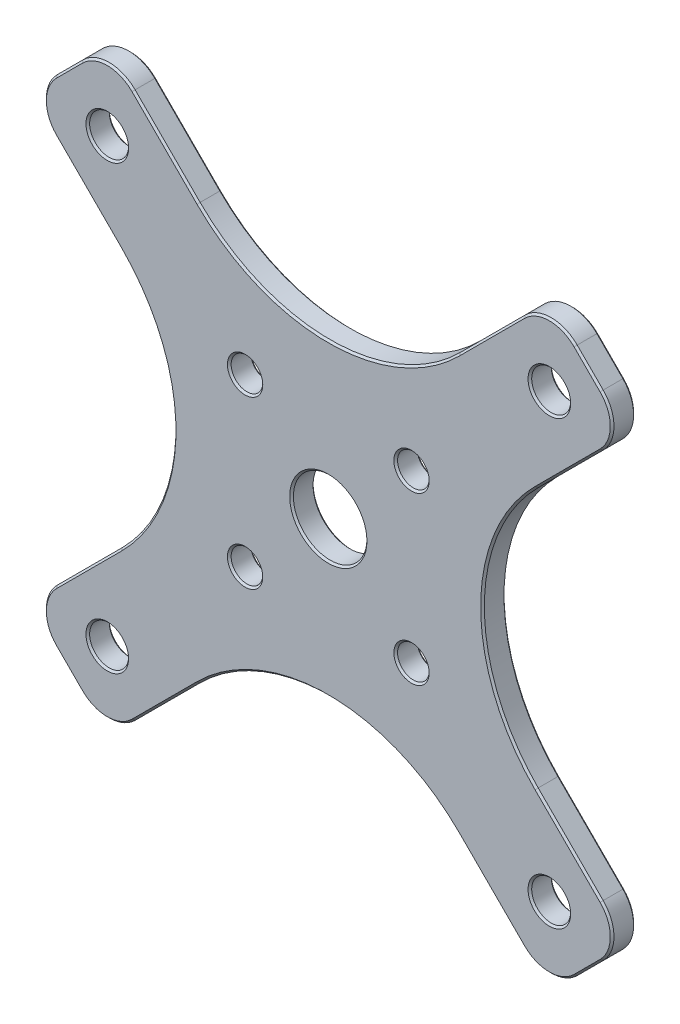
from build123d import *

# Parameters (mm, degrees)
SKETCH1_R            = 5
BOSS_EXTRUDE1_DEPTH  = 1.5875
M4_CLEARANCE_HOLE1_D = 4.3
M5_CLEARANCE_HOLE1_D = 5.3
FILLET1_R            = 25
FILLET2_R            = 5
CHAMFER1_SIZE        = 0.25


with BuildPart() as part:
    # Sketch1 → Boss-Extrude1 (new, symmetric)
    with BuildSketch(Plane.XY):
        Polygon((0, 10.606601718), (30.0520382, 40.658639918), (40.658639918, 30.0520382), (10.606601718, 0), (40.658639918, -30.0520382), (30.0520382, -40.658639918), (0, -10.606601718), (-30.0520382, -40.658639918), (-40.658639918, -30.0520382), (-10.606601718, 0), (-40.658639918, 30.0520382), (-30.0520382, 40.658639918), align=None)
        Circle(SKETCH1_R, mode=Mode.SUBTRACT)
    extrude(amount=BOSS_EXTRUDE1_DEPTH, both=True)

    # M4 Clearance Hole1 (through all)
    with Locations(Plane.XY.offset(1.5875)):
        with Locations((-11.313708499, 11.313708499), (11.313708499, 11.313708499), (11.313708499, -11.313708499), (-11.313708499, -11.313708499)):
            Hole(M4_CLEARANCE_HOLE1_D / 2)

    # M5 Clearance Hole1 (through all)
    with Locations(Plane(origin=(0, 0, -1.5875), x_dir=(-1, 0, 0), z_dir=(0, 0, -1))):
        with Locations((-30.0520382, 30.0520382), (30.0520382, 30.0520382), (30.0520382, -30.0520382), (-30.0520382, -30.0520382)):
            Hole(M5_CLEARANCE_HOLE1_D / 2)

    # Fillet1
    fillet1_edges = [part.edges().sort_by_distance(p)[0] for p in [
        (0, 10.606601718, 0),
        (10.606601718, 0, 0),
        (0, -10.606601718, 0),
        (-10.606601718, 0, 0),
    ]]
    fillet(fillet1_edges, radius=FILLET1_R)

    # Fillet2
    fillet2_edges = [part.edges().sort_by_distance(p)[0] for p in [
        (30.0520382, 40.658639918, 0),
        (40.658639918, 30.0520382, 0),
        (40.658639918, -30.0520382, 0),
        (30.0520382, -40.658639918, 0),
        (-30.0520382, -40.658639918, 0),
        (-40.658639918, -30.0520382, 0),
        (-40.658639918, 30.0520382, 0),
        (-30.0520382, 40.658639918, 0),
    ]]
    fillet(fillet2_edges, radius=FILLET2_R)

    # Chamfer1
    chamfer1_edges = [part.edges().sort_by_distance(p)[0] for p in [
        (-22.097086912, 32.70368863, -1.5875),
        (-22.097086912, 32.70368863, 1.5875),
        (-20.961940777, 0, -1.5875),
        (-20.961940777, 0, 1.5875),
        (0, -20.961940777, -1.5875),
        (0, -20.961940777, 1.5875),
        (20.961940777, 0, -1.5875),
        (20.961940777, 0, 1.5875),
        (0, 20.961940777, -1.5875),
        (0, 20.961940777, 1.5875),
        (32.70368863, -22.097086912, -1.5875),
        (32.70368863, -22.097086912, 1.5875),
        (22.097086912, 32.70368863, -1.5875),
        (35.355339059, 35.355339059, -1.5875),
        (35.355339059, -35.355339059, -1.5875),
        (-22.097086912, -32.70368863, -1.5875),
        (-35.355339059, -35.355339059, -1.5875),
        (-32.70368863, 22.097086912, -1.5875),
        (-35.355339059, 35.355339059, -1.5875),
        (38.587572106, 30.0520382, -1.5875),
        (30.0520382, 38.587572106, -1.5875),
        (-30.0520382, 38.587572106, -1.5875),
        (-38.587572106, 30.0520382, -1.5875),
        (-38.587572106, -30.0520382, -1.5875),
        (-30.0520382, -38.587572106, -1.5875),
        (30.0520382, -38.587572106, -1.5875),
        (38.587572106, -30.0520382, -1.5875),
        (35.355339059, -35.355339059, 1.5875),
        (22.097086912, 32.70368863, 1.5875),
        (-35.355339059, 35.355339059, 1.5875),
        (-32.70368863, 22.097086912, 1.5875),
        (-35.355339059, -35.355339059, 1.5875),
        (-22.097086912, -32.70368863, 1.5875),
        (35.355339059, 35.355339059, 1.5875),
        (38.587572106, 30.0520382, 1.5875),
        (30.0520382, 38.587572106, 1.5875),
        (-30.0520382, 38.587572106, 1.5875),
        (-38.587572106, 30.0520382, 1.5875),
        (-38.587572106, -30.0520382, 1.5875),
        (-30.0520382, -38.587572106, 1.5875),
        (30.0520382, -38.587572106, 1.5875),
        (38.587572106, -30.0520382, 1.5875),
        (-5, 0, -1.5875),
        (-5, 0, 1.5875),
        (-9.163708499, 11.313708499, 1.5875),
        (-9.163708499, 11.313708499, -1.5875),
        (-9.163708499, -11.313708499, 1.5875),
        (-9.163708499, -11.313708499, -1.5875),
        (13.463708499, -11.313708499, 1.5875),
        (13.463708499, -11.313708499, -1.5875),
        (13.463708499, 11.313708499, 1.5875),
        (13.463708499, 11.313708499, -1.5875),
        (27.4020382, -30.0520382, -1.5875),
        (27.4020382, -30.0520382, 1.5875),
        (-32.7020382, -30.0520382, -1.5875),
        (-32.7020382, -30.0520382, 1.5875),
        (-32.7020382, 30.0520382, -1.5875),
        (-32.7020382, 30.0520382, 1.5875),
        (27.4020382, 30.0520382, -1.5875),
        (27.4020382, 30.0520382, 1.5875),
        (-32.70368863, -22.097086912, -1.5875),
        (-32.70368863, -22.097086912, 1.5875),
        (22.097086912, -32.70368863, -1.5875),
        (22.097086912, -32.70368863, 1.5875),
        (32.70368863, 22.097086912, -1.5875),
        (32.70368863, 22.097086912, 1.5875),
    ]]
    chamfer(chamfer1_edges, length=CHAMFER1_SIZE)


solid = part.part
